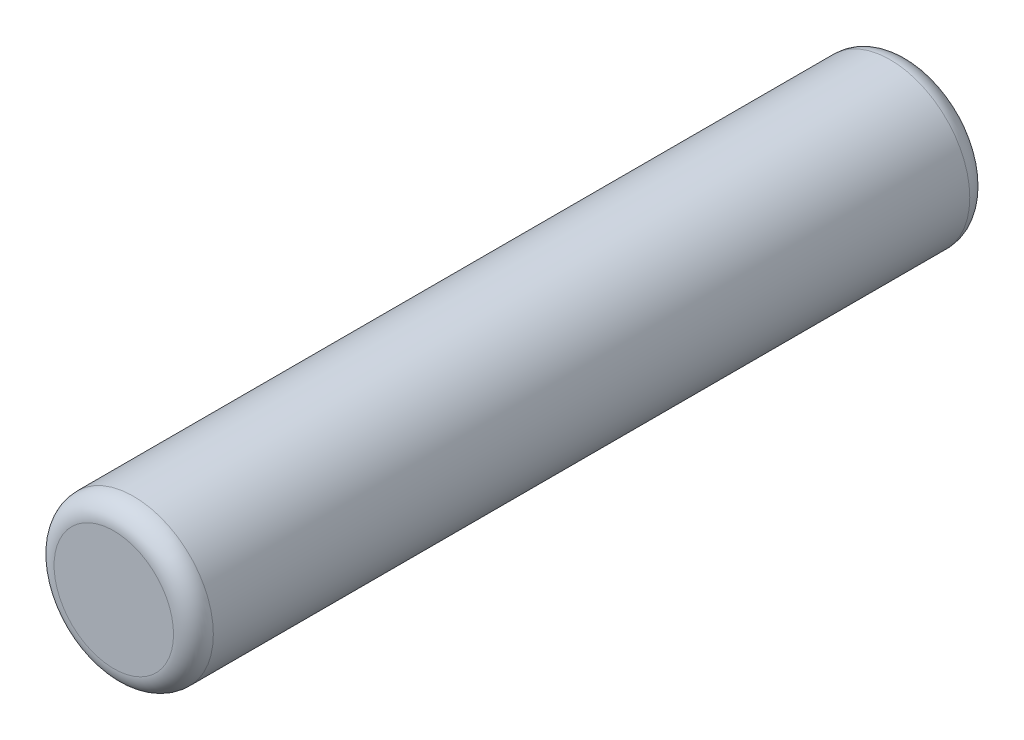
from build123d import *

# Parameters (mm, degrees)
SKETCH2_R           = 4
BOSS_EXTRUDE1_DEPTH = 20
FILLET1_R           = 1


with BuildPart() as part:
    # Sketch2 → Boss-Extrude1 (new, symmetric)
    with BuildSketch(Plane.XY):
        Circle(SKETCH2_R)
    extrude(amount=BOSS_EXTRUDE1_DEPTH, both=True)

    # Fillet1
    fillet1_edges = [part.edges().sort_by_distance(p)[0] for p in [
        (-4, 0, -20),
        (-4, 0, 20),
    ]]
    fillet(fillet1_edges, radius=FILLET1_R)


solid = part.part
